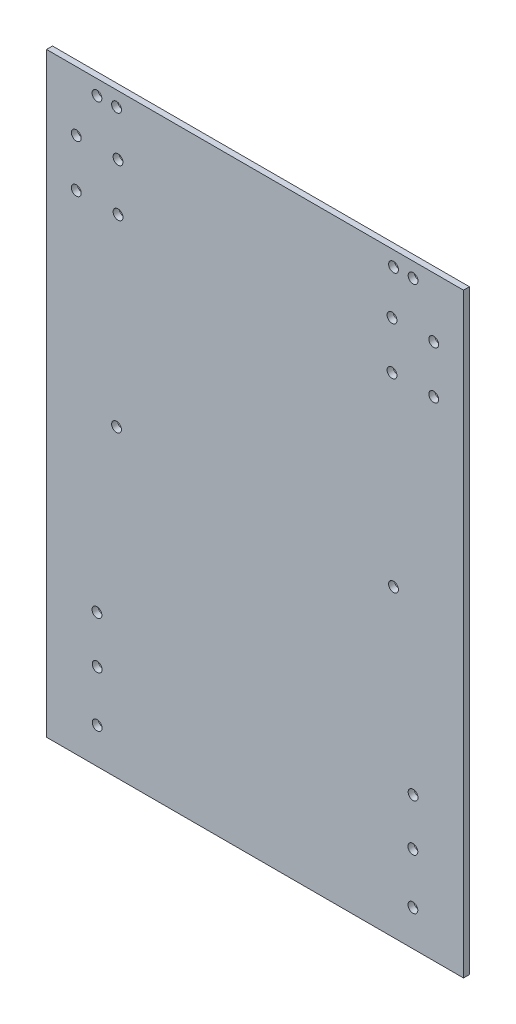
from build123d import *

# Parameters (mm, degrees)
SKETCH_1_W          = 140
SKETCH_1_H          = 200
EXTRUDE_1_DEPTH     = 2
SKETCH_3_R          = 1.65
CUT_EXTRUDE_1_DEPTH = 5


with BuildPart() as part:
    # 草图1 → 凸台-拉伸1 (new body)
    with BuildSketch(Plane.XY):
        with Locations((35.815329949, -60.510812183)):
            Rectangle(SKETCH_1_W, SKETCH_1_H)
    extrude(amount=EXTRUDE_1_DEPTH)

    # 草图3 → 切除-拉伸1 (cut)
    with BuildSketch(Plane.XY.offset(2)):
        with Locations((-10.684670051, 34.489187817)):
            Circle(SKETCH_3_R)
        with Locations((82.315329949, 34.489187817)):
            Circle(SKETCH_3_R)
        with Locations((82.315329949, -58.510812183)):
            Circle(SKETCH_3_R)
        with Locations((-10.684670051, -58.510812183)):
            Circle(SKETCH_3_R)
        with Locations((-24.184670051, 19.489187817)):
            Circle(SKETCH_3_R)
        with Locations((-10.184670051, 19.489187817)):
            Circle(SKETCH_3_R)
        with Locations((-24.184670051, 3.489187817)):
            Circle(SKETCH_3_R)
        with Locations((-10.184670051, 3.489187817)):
            Circle(SKETCH_3_R)
        with Locations((81.815329949, 3.489187817)):
            Circle(SKETCH_3_R)
        with Locations((95.815329949, 3.489187817)):
            Circle(SKETCH_3_R)
        with Locations((81.815329949, 19.489187817)):
            Circle(SKETCH_3_R)
        with Locations((95.815329949, 19.489187817)):
            Circle(SKETCH_3_R)
        with Locations((-17.184670051, -131.510812183)):
            Circle(SKETCH_3_R)
        with Locations((-17.184670051, -148.510812183)):
            Circle(SKETCH_3_R)
        with Locations((88.815329949, -148.510812183)):
            Circle(SKETCH_3_R)
        with Locations((88.815329949, -131.510812183)):
            Circle(SKETCH_3_R)
        with Locations((-17.254670051, 34.489187817)):
            Circle(SKETCH_3_R)
        with Locations((88.885329949, 34.489187817)):
            Circle(SKETCH_3_R)
        with Locations((88.885329949, -115.720812183)):
            Circle(SKETCH_3_R)
        with Locations((-17.254670051, -115.720812183)):
            Circle(SKETCH_3_R)
    extrude(amount=-CUT_EXTRUDE_1_DEPTH, mode=Mode.SUBTRACT)


solid = part.part
